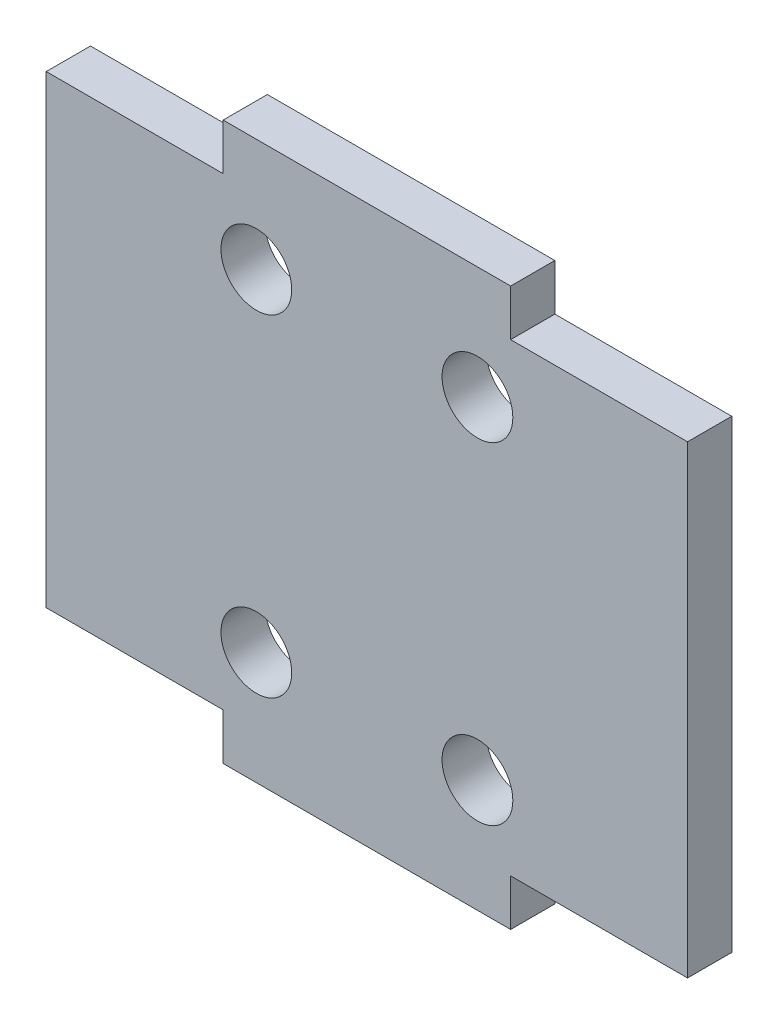
from build123d import *

# Parameters (mm, degrees)
SKETCH_1_W      = 29
SKETCH_1_H      = 21
SKETCH_1_R      = 1.6
SKETCH_1_W_2    = 13
SKETCH_1_H_2    = 2.1
EXTRUDE_1_DEPTH = 2


with BuildPart() as part:
    # 草图1 → 凸台-拉伸1 (new body)
    # profile 1 of 3: a face of its own
    with BuildSketch(Plane.XY):
        with Locations((14.5, 10.5)):
            Rectangle(SKETCH_1_W, SKETCH_1_H)
        with Locations((9.5, 18)):
            Circle(SKETCH_1_R, mode=Mode.SUBTRACT)
        with Locations((19.5, 18)):
            Circle(SKETCH_1_R, mode=Mode.SUBTRACT)
        with Locations((9.5, 3)):
            Circle(SKETCH_1_R, mode=Mode.SUBTRACT)
        with Locations((19.5, 3)):
            Circle(SKETCH_1_R, mode=Mode.SUBTRACT)
    # profile 2 of 3: a face of its own
    with BuildSketch(Plane.XY):
        with Locations((14.5, -1.05)):
            Rectangle(SKETCH_1_W_2, SKETCH_1_H_2)
    # profile 3 of 3: a face of its own
    with BuildSketch(Plane.XY):
        with Locations((14.5, 22.05)):
            Rectangle(SKETCH_1_W_2, SKETCH_1_H_2)
    extrude(amount=EXTRUDE_1_DEPTH)


solid = part.part
